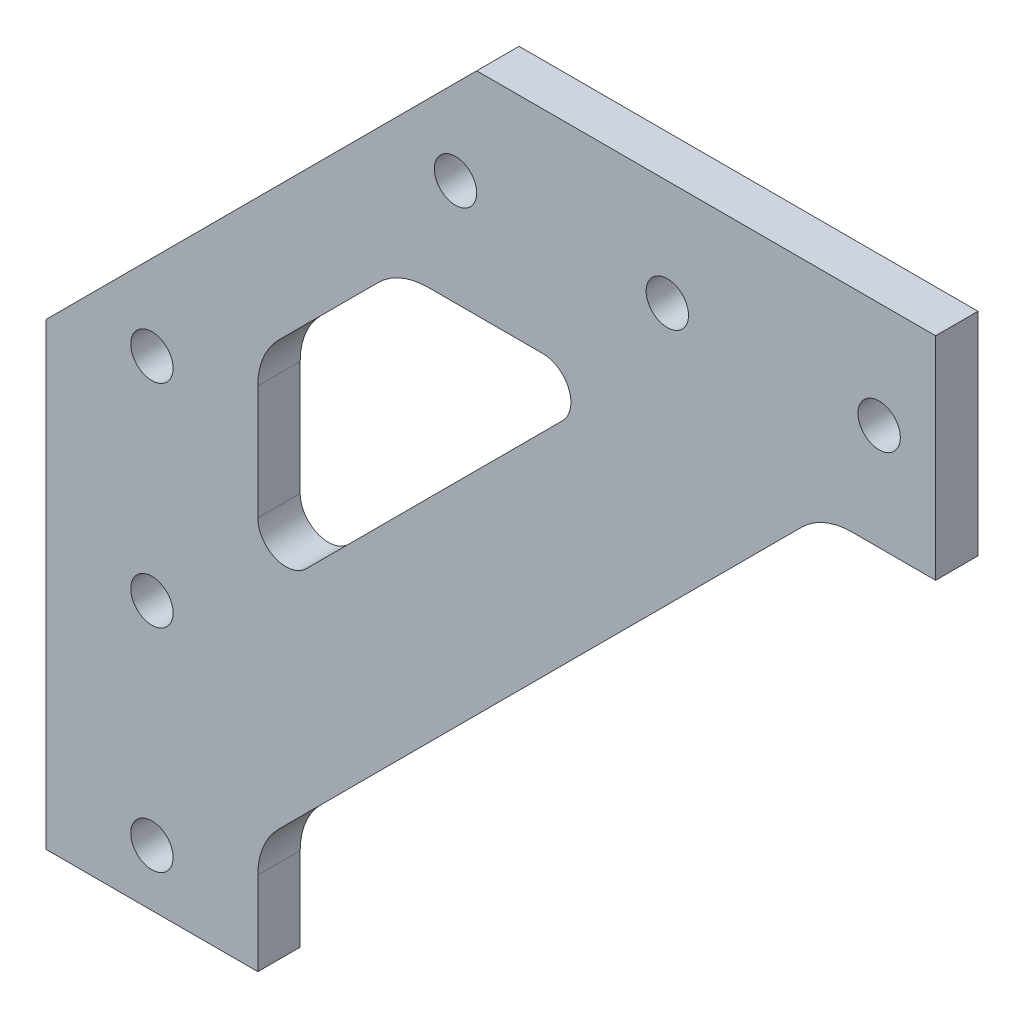
from build123d import *

# Parameters (mm, degrees)
EXTRUDE_1_DEPTH     = 3
SKETCH_2_R          = 1.5
CUT_EXTRUDE_1_DEPTH = 10


with BuildPart() as part:
    # 草图1 → 凸台-拉伸1 (new body)
    with BuildSketch(Plane.XY):
        with BuildLine():
            Line((32.5, 0), (32.5, -15))
            Line((32.5, -15), (26.571067812, -15))
            ThreePointArc((26.571067812, -15), (24.65765065, -15.380602337), (23.035533906, -16.464466094))
            Line((23.035533906, -16.464466094), (-14.035533906, -53.535533906))
            ThreePointArc((-14.035533906, -53.535533906), (-15.119397663, -55.15765065), (-15.5, -57.071067812))
            Line((-15.5, -57.071067812), (-15.5, -63))
            Line((-15.5, -63), (-30.5, -63))
            Line((-30.5, -63), (-30.5, -30.5))
            Line((-30.5, -30.5), (0, 0))
            Line((0, 0), (32.5, 0))
        make_face()
        with BuildLine():
            Line((-12.085786438, -36.585786438), (6.085786438, -18.414213562))
            ThreePointArc((6.085786438, -18.414213562), (6.51933194, -16.234633135), (4.671572875, -15))
            Line((4.671572875, -15), (-3.428932188, -15))
            ThreePointArc((-3.428932188, -15), (-5.34234935, -15.380602337), (-6.964466094, -16.464466094))
            Line((-6.964466094, -16.464466094), (-14.035533906, -23.535533906))
            ThreePointArc((-14.035533906, -23.535533906), (-15.119397663, -25.15765065), (-15.5, -27.071067812))
            Line((-15.5, -27.071067812), (-15.5, -35.171572875))
            ThreePointArc((-15.5, -35.171572875), (-14.265366865, -37.01933194), (-12.085786438, -36.585786438))
        make_face(mode=Mode.SUBTRACT)
    extrude(amount=EXTRUDE_1_DEPTH)

    # 草图2 → 切除-拉伸1 (cut)
    with BuildSketch(Plane.XY.offset(3)):
        with Locations((28.5, -7.5)):
            Circle(SKETCH_2_R)
        with Locations((13.5, -7.5)):
            Circle(SKETCH_2_R)
        with Locations((-1.5, -7.5)):
            Circle(SKETCH_2_R)
        with Locations((-23, -29)):
            Circle(SKETCH_2_R)
        with Locations((-23, -44)):
            Circle(SKETCH_2_R)
        with Locations((-23, -59)):
            Circle(SKETCH_2_R)
    extrude(amount=-CUT_EXTRUDE_1_DEPTH, mode=Mode.SUBTRACT)


solid = part.part
